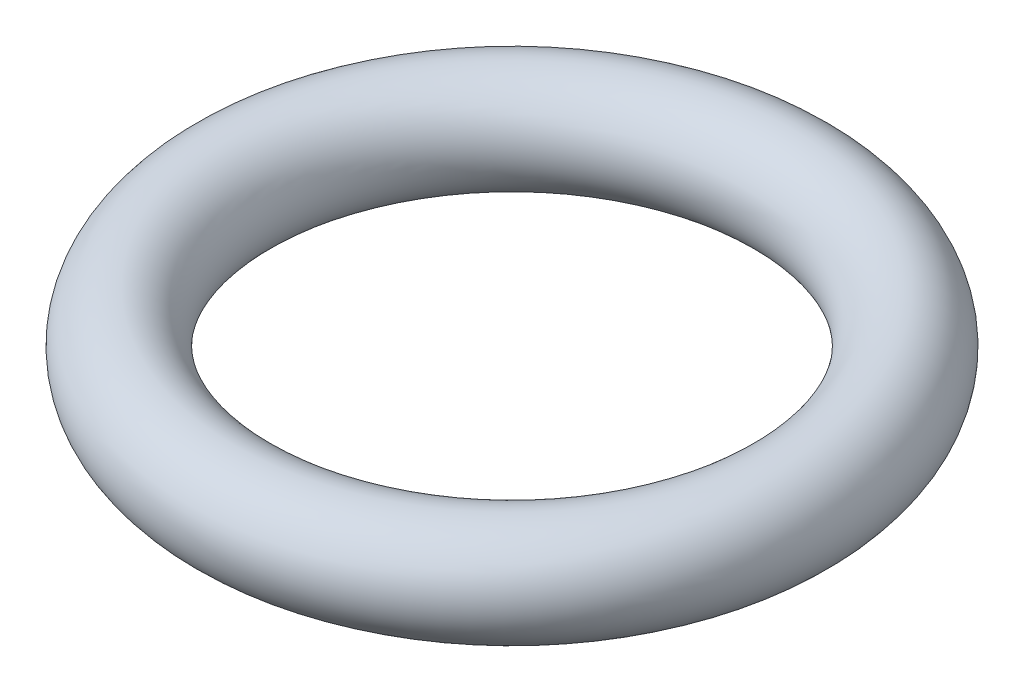
from build123d import *

# Parameters (mm, degrees)
SKETCH1_R = 1.25


with BuildPart() as part:
    # Sketch1 → Revolve1 (revolve)
    with BuildSketch(Plane.XY, mode=Mode.PRIVATE) as revolve1_sk:
        with Locations((6.75, 0)):
            Circle(SKETCH1_R)
    revolve(revolve1_sk.sketch.rotate(Axis((0, 0, 0), (0, 1, 0)), 90), axis=Axis((0, 0, 0), (0, 1, 0)))


solid = part.part
